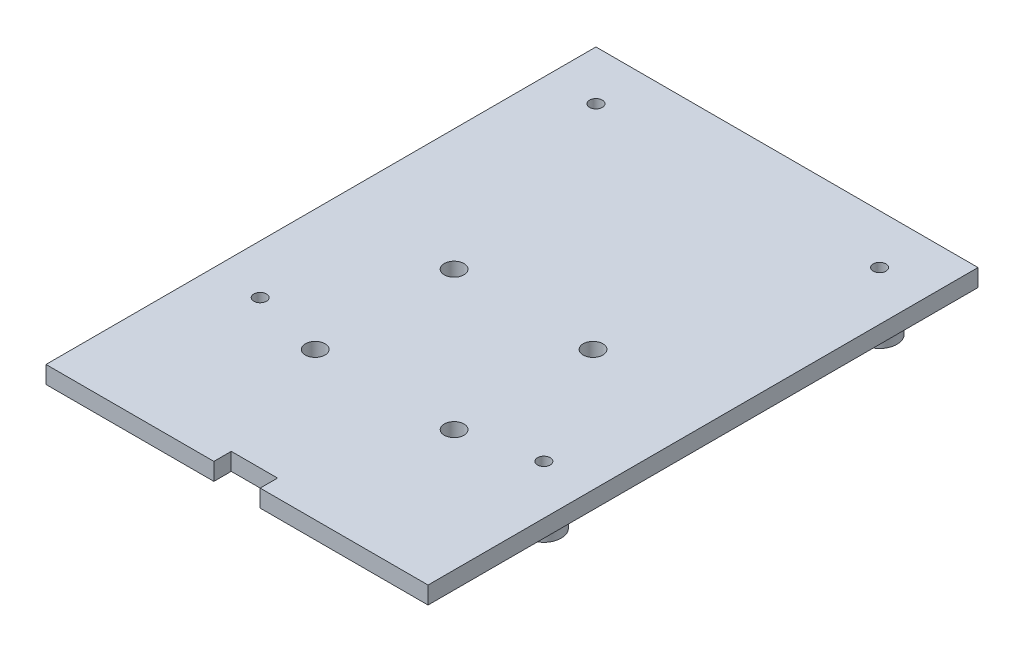
from build123d import *

# Parameters (mm, degrees)
SKETCH1_W                       = 66
SKETCH1_H                       = 95
CRADLE_BASE_DEPTH               = 3
SKETCH2_R                       = 3
STANDOFFS_DEPTH                 = 10
PILOT_AND_BOLT_HOLES_DEPTH      = 144.412865532
PILOT_AND_BOLT_HOLES_DEPTH_BACK = 144.412865532
SKETCH3_R                       = 1.1
SKETCH3_R_2                     = 1.7
USB_END_NOTCH_DEPTH             = 144.412865532
USB_END_NOTCH_DEPTH_BACK        = 144.412865532
SKETCH4_W                       = 8
SKETCH4_H                       = 4


with BuildPart() as part:
    # Sketch1 → Cradle Base (new body)
    with BuildSketch(Plane(origin=(0, 0, 0), x_dir=(1, 0, 0), z_dir=(0, 1, 0))):
        with Locations((-98, 10)):
            Rectangle(SKETCH1_W, SKETCH1_H)
    extrude(amount=-CRADLE_BASE_DEPTH)

    # Sketch2 → Standoffs (add)
    with BuildSketch(Plane(origin=(0, 0, 0), x_dir=(1, 0, 0), z_dir=(0, 1, 0))):
        with Locations(Location((-122.5, 49, 0), (0, 0, 270))):
            Circle(SKETCH2_R)
        with Locations(Location((-122.5, -9, 0), (0, 0, 270))):
            Circle(SKETCH2_R)
        with Locations(Location((-73.5, 49, 0), (0, 0, 270))):
            Circle(SKETCH2_R)
        with Locations(Location((-73.5, -9, 0), (0, 0, 270))):
            Circle(SKETCH2_R)
    extrude(amount=-STANDOFFS_DEPTH)

    # Sketch3 → Pilot and Bolt Holes (cut, two sides: drawn at the far end of the back side and taken through both)
    with BuildSketch(Plane(origin=(0, 0, 0), x_dir=(1, 0, 0), z_dir=(0, 1, 0)).offset(-PILOT_AND_BOLT_HOLES_DEPTH_BACK)):
        with Locations(Location((-122.5, 49, 0), (0, 0, 270))):
            Circle(SKETCH3_R)
        with Locations(Location((-122.5, -9, 0), (0, 0, 270))):
            Circle(SKETCH3_R)
        with Locations(Location((-73.5, 49, 0), (0, 0, 270))):
            Circle(SKETCH3_R)
        with Locations(Location((-73.5, -9, 0), (0, 0, 270))):
            Circle(SKETCH3_R)
        with Locations(Location((-110, -12, 0), (0, 0, 270))):
            Circle(SKETCH3_R_2)
        with Locations(Location((-110, 12, 0), (0, 0, 270))):
            Circle(SKETCH3_R_2)
        with Locations(Location((-86, -12, 0), (0, 0, 270))):
            Circle(SKETCH3_R_2)
        with Locations(Location((-86, 12, 0), (0, 0, 270))):
            Circle(SKETCH3_R_2)
    extrude(amount=PILOT_AND_BOLT_HOLES_DEPTH + PILOT_AND_BOLT_HOLES_DEPTH_BACK, mode=Mode.SUBTRACT)

    # Sketch4 → USB End Notch (cut, two sides: drawn at the far end of the back side and taken through both)
    with BuildSketch(Plane(origin=(0, 0, 0), x_dir=(1, 0, 0), z_dir=(0, 1, 0)).offset(-USB_END_NOTCH_DEPTH_BACK)):
        with Locations((-98, -36.5)):
            Rectangle(SKETCH4_W, SKETCH4_H)
    extrude(amount=USB_END_NOTCH_DEPTH + USB_END_NOTCH_DEPTH_BACK, mode=Mode.SUBTRACT)


solid = part.part
